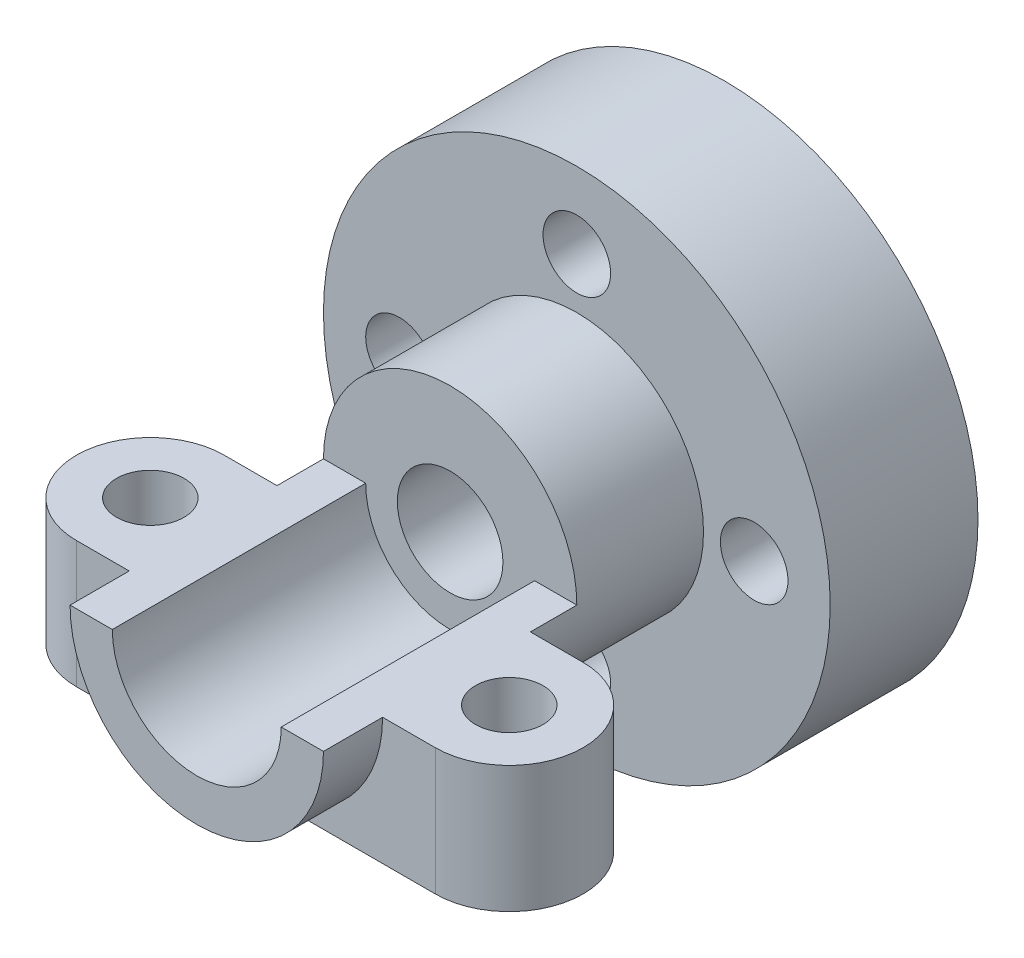
from build123d import *

# Parameters (mm, degrees)
BOSS_EXTRUDE1_DEPTH         = 125
SKETCH1_4_R                 = 12.5
BOSS_EXTRUDE2_DEPTH         = 65
SKETCH1_5_R                 = 60
SKETCH1_5_R_2               = 8
SKETCH1_5_R_3               = 30
BOSS_EXTRUDE3_DEPTH         = 35
BOSS_EXTRUDE4_START         = -49
BOSS_EXTRUDE4_DEPTH         = 35
FILLET1_RADIUS              = 17.5
FILLET1_LENGTH              = 30
F_16_0_16_DIAMETER_HOLE1_D  = 16
FILLET1_OF_MIRROR1_2_RADIUS = 17.5
FILLET1_OF_MIRROR1_2_LENGTH = 30
SKETCH5_R                   = 53.79037733
CUT_EXTRUDE2_DEPTH          = 10


with BuildPart() as part:
    # Sketch1 → Boss-Extrude1 (new body)
    with BuildSketch(Plane.XY):
        with BuildLine():
            Line((30, 0), (20, 0))
            ThreePointArc((20, 0), (0, -20), (-20, 0))
            Line((-20, 0), (-30, 0))
            ThreePointArc((-30, 0), (0, -30), (30, 0))
        make_face()
    extrude(amount=BOSS_EXTRUDE1_DEPTH)

    # Sketch1<4> → Boss-Extrude2 (add)
    with BuildSketch(Plane.XY):
        with BuildLine():
            ThreePointArc((-20, 0), (0, -20), (20, 0))
            Line((20, 0), (30, 0))
            ThreePointArc((30, 0), (0, 30), (-30, 0))
            Line((-30, 0), (-20, 0))
        make_face()
        Circle(SKETCH1_4_R, mode=Mode.SUBTRACT)
    extrude(amount=BOSS_EXTRUDE2_DEPTH)

    # Sketch1<5> → Boss-Extrude3 (add)
    with BuildSketch(Plane.XY):
        Circle(SKETCH1_5_R)
        with Locations((0, 42)):
            Circle(SKETCH1_5_R_2, mode=Mode.SUBTRACT)
        with Locations((-42, 0)):
            Circle(SKETCH1_5_R_2, mode=Mode.SUBTRACT)
        with Locations((0, -42)):
            Circle(SKETCH1_5_R_2, mode=Mode.SUBTRACT)
        with Locations((42, 0)):
            Circle(SKETCH1_5_R_2, mode=Mode.SUBTRACT)
        Circle(SKETCH1_5_R_3, mode=Mode.SUBTRACT)
    extrude(amount=BOSS_EXTRUDE3_DEPTH)

    # Sketch2 → Boss-Extrude4 (add)
    with BuildSketch(Plane.XY.offset(125).offset(BOSS_EXTRUDE4_START)):
        with BuildLine():
            Line((30, 0), (60, 0))
            Line((60, 0), (60, -26.364821455))
            Line((60, -26.364821455), (60, -30))
            Line((60, -30), (0, -30))
            ThreePointArc((0, -30), (21.213203436, -21.213203436), (30, 0))
        make_face()
    boss_extrude4 = extrude(amount=BOSS_EXTRUDE4_DEPTH)

    # Fillet1: full round fillet: the end face becomes a half cylinder, R = half its width
    fillet1_face = Plane((60, -15, 93.5), x_dir=(0, 1, 0), z_dir=(1, 0, 0))  # on the end face: x along it, z out of the body
    fillet1_slab = fillet1_face.offset(-FILLET1_RADIUS / 2) * Box(FILLET1_LENGTH, 2 * FILLET1_RADIUS, FILLET1_RADIUS, mode=Mode.PRIVATE)  # the body's end, R deep
    fillet1_round = Plane((42.5, -15, 93.5), x_dir=(1, 0, 0), z_dir=(0, 1, 0)) * Cylinder(FILLET1_RADIUS, FILLET1_LENGTH, mode=Mode.PRIVATE)  # its axis R under the face
    add(fillet1_slab - fillet1_round, mode=Mode.SUBTRACT)

    # Ø16.0 (16) Diameter Hole1 (through all)
    with Locations(Plane(origin=(42.5, 0, 93.5), x_dir=(1, 0, 0), z_dir=(0, 1, 0))):
        with Locations((0, 0)):
            f_16_0_16_diameter_hole1 = Hole(F_16_0_16_DIAMETER_HOLE1_D / 2)

    # Mirror1: Boss-Extrude4, Ø16.0 (16) Diameter Hole1 across plane
    add(boss_extrude4.mirror(Plane(origin=(0, 0, 0), x_dir=(0, 0, 1), z_dir=(1, 0, 0))))
    add(f_16_0_16_diameter_hole1.mirror(Plane(origin=(0, 0, 0), x_dir=(0, 0, 1), z_dir=(1, 0, 0))), mode=Mode.SUBTRACT)

    # Fillet1 of Mirror1 2: full round fillet: the end face becomes a half cylinder, R = half its width
    fillet1_of_mirror1_2_face = Plane((-60, -15, 93.5), x_dir=(0, 1, 0), z_dir=(-1, 0, 0))  # on the end face: x along it, z out of the body
    fillet1_of_mirror1_2_slab = fillet1_of_mirror1_2_face.offset(-FILLET1_OF_MIRROR1_2_RADIUS / 2) * Box(FILLET1_OF_MIRROR1_2_LENGTH, 2 * FILLET1_OF_MIRROR1_2_RADIUS, FILLET1_OF_MIRROR1_2_RADIUS, mode=Mode.PRIVATE)  # the body's end, R deep
    fillet1_of_mirror1_2_round = Plane((-42.5, -15, 93.5), x_dir=(-1, 0, 0), z_dir=(0, 1, 0)) * Cylinder(FILLET1_OF_MIRROR1_2_RADIUS, FILLET1_OF_MIRROR1_2_LENGTH, mode=Mode.PRIVATE)  # its axis R under the face
    add(fillet1_of_mirror1_2_slab - fillet1_of_mirror1_2_round, mode=Mode.SUBTRACT)

    # Sketch5 → Cut-Extrude2 (cut)
    with BuildSketch(Plane(origin=(0, 0, 0), x_dir=(-1, 0, 0), z_dir=(0, 0, -1))):
        Circle(SKETCH5_R)
    extrude(amount=-CUT_EXTRUDE2_DEPTH, mode=Mode.SUBTRACT)


solid = part.part
